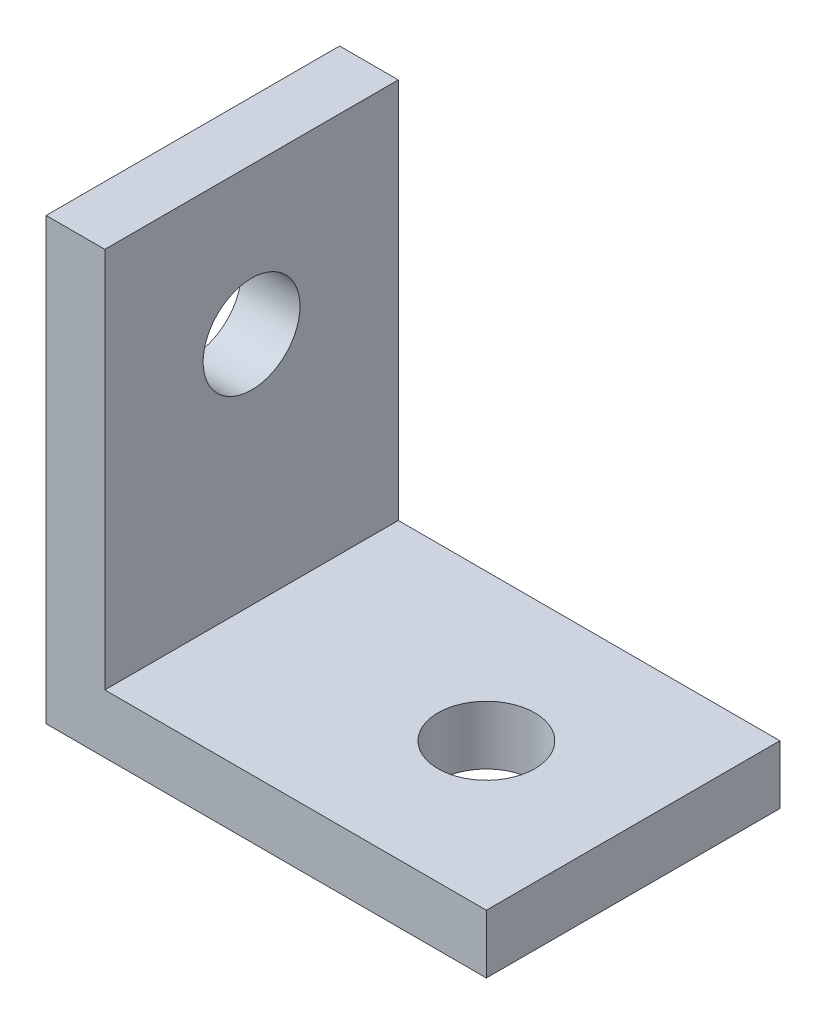
from build123d import *

# Parameters (mm, degrees)
RESSALTO_EXTRUS_O2_DEPTH                   = 10
BROCA_DE_ROSQUEAR_PARA_TARRAXA_DE_M4X0_7_D = 3.3
BROCA_DE_ROSQUEAR_PARA_TARRAXA_DE_M4_2_D   = 3.3


with BuildPart() as part:
    # Esboço1 → Ressalto-extrusão2 (new body)
    with BuildSketch(Plane.XY):
        Polygon((0, 0), (15, 0), (15, 2), (2, 2), (2, 15), (0, 15), align=None)
    extrude(amount=RESSALTO_EXTRUS_O2_DEPTH)

    # Broca de rosquear para tarraxa de M4x0.7 (through all)
    with Locations(Plane(origin=(2, 10, 5), x_dir=(0, 0, 1), z_dir=(1, 0, 0))):
        with Locations((0, 0)):
            Hole(BROCA_DE_ROSQUEAR_PARA_TARRAXA_DE_M4X0_7_D / 2)

    # Broca de rosquear para tarraxa de M4 2 (through all)
    with Locations(Plane(origin=(10, 0, 5), x_dir=(0, 0, -1), z_dir=(0, -1, 0))):
        with Locations((0, 0)):
            Hole(BROCA_DE_ROSQUEAR_PARA_TARRAXA_DE_M4_2_D / 2)


solid = part.part
